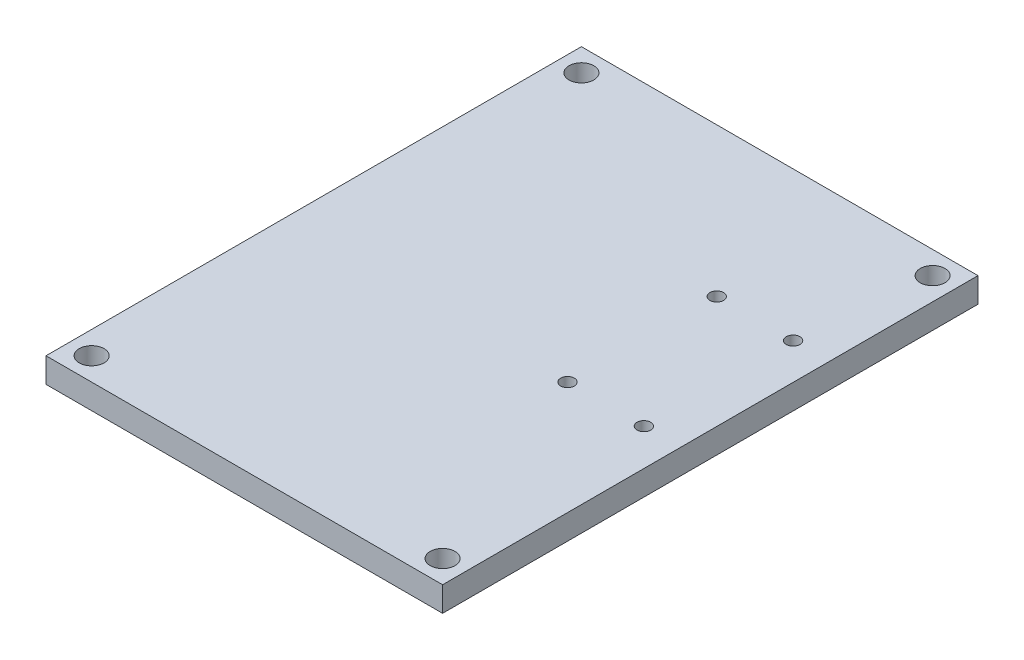
from build123d import *

# Parameters (mm, degrees)
SKETCH1_W           = 101.6
SKETCH1_H           = 137.16
BOSS_EXTRUDE2_DEPTH = 6.35
SKETCH2_R           = 3.175
CUT_EXTRUDE1_DEPTH  = 6.35
SKETCH3_R           = 1.7526
CUT_EXTRUDE2_DEPTH  = 6.35


with BuildPart() as part:
    # Sketch1 → Boss-Extrude2 (new body)
    with BuildSketch(Plane(origin=(0, 0, 0), x_dir=(1, 0, 0), z_dir=(0, 1, 0))):
        Rectangle(SKETCH1_W, SKETCH1_H)
    extrude(amount=BOSS_EXTRUDE2_DEPTH)

    # Sketch2 → Cut-Extrude1 (cut)
    with BuildSketch(Plane(origin=(0, 6.35, 0), x_dir=(1, 0, 0), z_dir=(0, 1, 0))):
        with Locations(Location((-44.988792978, 62.768792978, 0), (0, 0, 270))):
            Circle(SKETCH2_R)
        with Locations(Location((44.98369299, 62.76369299, 0), (0, 0, 270))):
            Circle(SKETCH2_R)
        with Locations(Location((-44.951429569, -62.731429569, 0), (0, 0, 270))):
            Circle(SKETCH2_R)
        with Locations(Location((44.98369299, -62.76369299, 0), (0, 0, 270))):
            Circle(SKETCH2_R)
    extrude(amount=-CUT_EXTRUDE1_DEPTH, mode=Mode.SUBTRACT)

    # Sketch3 → Cut-Extrude2 (cut)
    with BuildSketch(Plane(origin=(0, 6.35, 0), x_dir=(1, 0, 0), z_dir=(0, 1, 0))):
        with Locations(Location((21.971, 30.48, 0), (0, 0, 270))):
            Circle(SKETCH3_R)
        with Locations(Location((41.529, 30.48, 0), (0, 0, 270))):
            Circle(SKETCH3_R)
        with Locations(Location((21.844, -7.62, 0), (0, 0, 270))):
            Circle(SKETCH3_R)
        with Locations(Location((41.402, -7.62, 0), (0, 0, 270))):
            Circle(SKETCH3_R)
    extrude(amount=-CUT_EXTRUDE2_DEPTH, mode=Mode.SUBTRACT)


solid = part.part
